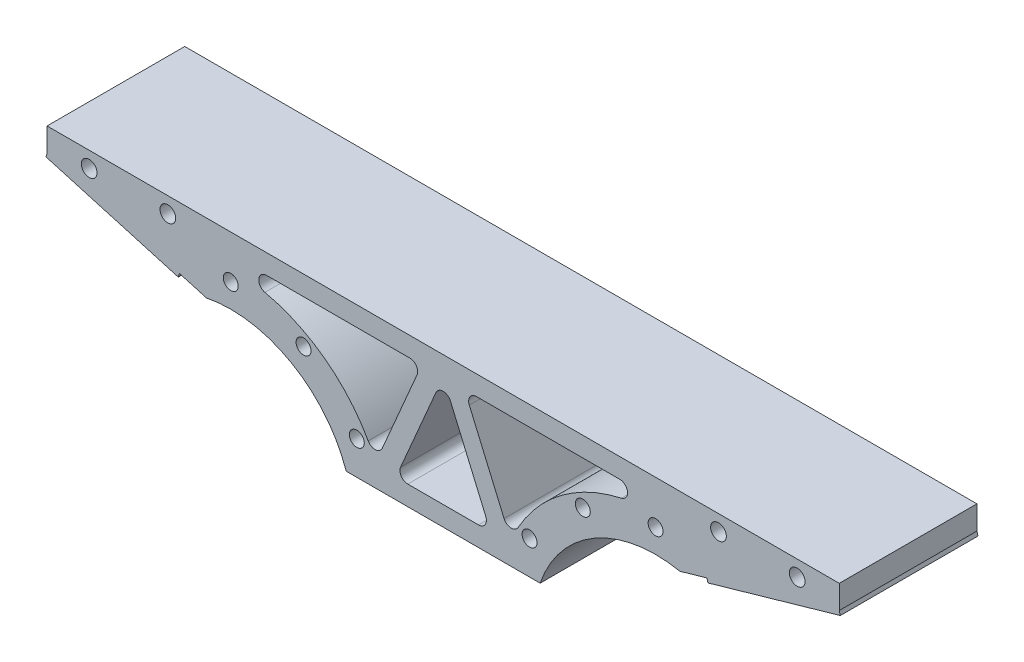
from build123d import *

# Parameters (mm, degrees)
SKETCH_1_R          = 1.9
SKETCH_1_R_2        = 2
EXTRUDE_1_DEPTH     = 35
EXTRUDE_2_DEPTH     = 35
CUT_EXTRUDE_1_DEPTH = 118.156356153
SKETCH_4_R          = 41.5
CUT_EXTRUDE_2_DEPTH = 5.5
SKETCH_5_R          = 31
CUT_EXTRUDE_3_DEPTH = 116.632442624


with BuildPart() as part:
    # 草图1 → 凸台-拉伸1 (new body)
    with BuildSketch(Plane.XY):
        with BuildLine():
            Line((-46.419972715, 26.434696638), (-100.702636481, 42))
            Line((-100.702636481, 42), (-100.702636481, 48))
            Line((-100.702636481, 48), (100.702636481, 48))
            Line((100.702636481, 48), (100.702636481, 42))
            Line((100.702636481, 42), (46.419972715, 26.434696638))
            ThreePointArc((46.419972715, 26.434696638), (35.478614393, 20.327525063), (28.382623085, 10))
            Line((28.382623085, 10), (-28.382623085, 10))
            ThreePointArc((-28.382623085, 10), (-35.478614393, 20.327525063), (-46.419972715, 26.434696638))
        make_face()
        with Locations((-54, 37)):
            Circle(SKETCH_1_R, mode=Mode.SUBTRACT)
        with Locations((-35.5, 32.04293994)):
            Circle(SKETCH_1_R, mode=Mode.SUBTRACT)
        with Locations((-21.95706006, 18.5)):
            Circle(SKETCH_1_R, mode=Mode.SUBTRACT)
        with Locations(Location((21.95706006, 18.5, 0), (0, 0, 180))):
            Circle(SKETCH_1_R, mode=Mode.SUBTRACT)
        with Locations(Location((35.5, 32.04293994, 0), (0, 0, 180))):
            Circle(SKETCH_1_R, mode=Mode.SUBTRACT)
        with Locations(Location((54, 37, 0), (0, 0, 180))):
            Circle(SKETCH_1_R, mode=Mode.SUBTRACT)
        with Locations((-90, 44)):
            Circle(SKETCH_1_R_2, mode=Mode.SUBTRACT)
        with Locations((-70, 44)):
            Circle(SKETCH_1_R_2, mode=Mode.SUBTRACT)
        with Locations(Location((70, 44, 0), (0, 0, 180))):
            Circle(SKETCH_1_R_2, mode=Mode.SUBTRACT)
        with Locations(Location((90, 44, 0), (0, 0, 180))):
            Circle(SKETCH_1_R_2, mode=Mode.SUBTRACT)
    extrude(amount=EXTRUDE_1_DEPTH)

    # 草图2 → 凸台-拉伸2 (add)
    with BuildSketch(Plane.XY.offset(35)):
        Polygon((-100.702636481, 42), (-100.978273837, 41.038738304), (-67.334114479, 31.39143085), (-67.058477124, 32.352692546), align=None)
        Polygon((67.058477124, 32.352692546), (100.702636481, 42), (100.978273837, 41.038738304), (67.334114479, 31.39143085), align=None)
    extrude(amount=-EXTRUDE_2_DEPTH)

    # 草图3 → 切除-拉伸1 (cut, through all)
    with BuildSketch(Plane.XY.offset(35)):
        with BuildLine():
            Line((-6.641746516, 40.210125207), (-15.476556882, 19.658485028))
            ThreePointArc((-15.476556882, 19.658485028), (-17.211519663, 18.450985714), (-19.06092662, 19.474628401))
            ThreePointArc((-19.06092662, 19.474628401), (-30.09691848, 32.072460053), (-45.323396591, 39.047619048))
            ThreePointArc((-45.323396591, 39.047619048), (-46.877626016, 41.21821789), (-44.889566421, 43))
            Line((-44.889566421, 43), (-8.479162585, 43))
            ThreePointArc((-8.479162585, 43), (-6.808870756, 42.100056911), (-6.641746516, 40.210125207))
        make_face()
        with BuildLine():
            Line((-10.837416069, 17.789874793), (-1.837416069, 38.725781047))
            ThreePointArc((-1.837416069, 38.725781047), (0, 39.935906254), (1.837416069, 38.725781047))
            Line((1.837416069, 38.725781047), (10.837416069, 17.789874793))
            ThreePointArc((10.837416069, 17.789874793), (10.670291829, 15.899943089), (9, 15))
            Line((9, 15), (-9, 15))
            ThreePointArc((-9, 15), (-10.670291829, 15.899943089), (-10.837416069, 17.789874793))
        make_face()
        with BuildLine():
            Line((44.889566421, 43), (8.479162585, 43))
            ThreePointArc((8.479162585, 43), (6.808870756, 42.100056911), (6.641746516, 40.210125207))
            Line((6.641746516, 40.210125207), (15.476556882, 19.658485028))
            ThreePointArc((15.476556882, 19.658485028), (17.211519663, 18.450985714), (19.06092662, 19.474628401))
            ThreePointArc((19.06092662, 19.474628401), (30.09691848, 32.072460053), (45.323396591, 39.047619048))
            ThreePointArc((45.323396591, 39.047619048), (46.877626016, 41.21821789), (44.889566421, 43))
        make_face()
    extrude(amount=-CUT_EXTRUDE_1_DEPTH, mode=Mode.SUBTRACT)

    # 草图4 → 切除-拉伸2 (cut)
    with BuildSketch(Plane(origin=(0, 0, 0), x_dir=(-1, 0, 0), z_dir=(0, 0, -1))):
        with Locations((54, 0)):
            Circle(SKETCH_4_R)
        with Locations((-54, 0)):
            Circle(SKETCH_4_R)
    extrude(amount=-CUT_EXTRUDE_2_DEPTH, mode=Mode.SUBTRACT)

    # 草图5 → 切除-拉伸3 (cut, through all)
    with BuildSketch(Plane(origin=(0, 0, 5.5), x_dir=(-1, 0, 0), z_dir=(0, 0, -1))):
        with Locations((-54, 0)):
            Circle(SKETCH_5_R)
        with Locations((54, 0)):
            Circle(SKETCH_5_R)
    extrude(amount=-CUT_EXTRUDE_3_DEPTH, mode=Mode.SUBTRACT)


solid = part.part
